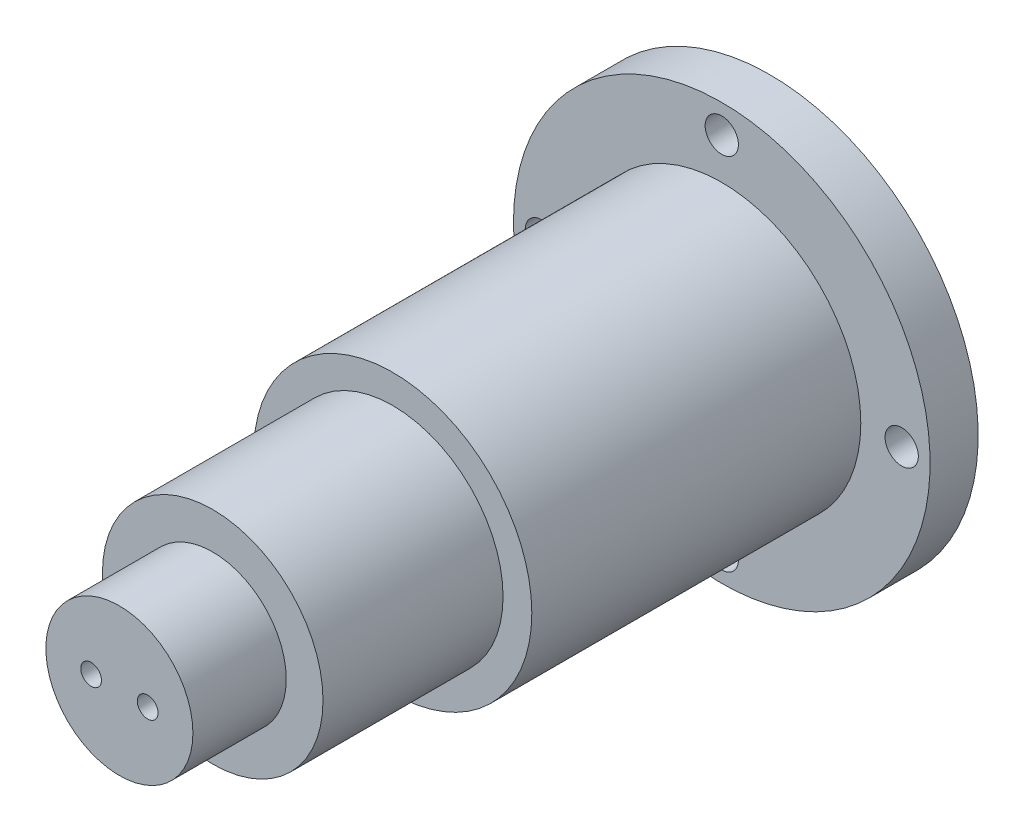
from build123d import *

# Parameters (mm, degrees)
SKETCH1_W                      = 22.1
SKETCH1_H                      = 5.1
SKETCH2_R                      = 14.75
BOSS_EXTRUDE1_DEPTH            = 34.9
SKETCH3_R                      = 11.7
BOSS_EXTRUDE2_DEPTH            = 19.1
SKETCH4_R                      = 7.8
BOSS_EXTRUDE3_DEPTH            = 9.9
M10_CLEARANCE_HOLE1_D          = 12.7
M10_CLEARANCE_HOLE1_DEPTH      = 18.81
M10_CLEARANCE_HOLE1_TIP        = 3.815464931
F_2_2_2_2_DIAMETER_HOLE1_D     = 2.2
F_2_2_2_2_DIAMETER_HOLE1_DEPTH = 15
M3_CLEARANCE_HOLE1_D           = 3.53
M3_CLEARANCE_HOLE1_DEPTH       = 69
CHAMFER1_SIZE                  = 2


with BuildPart() as part:
    # Sketch1 → Revolve1 (revolve)
    with BuildSketch(Plane.XZ, mode=Mode.PRIVATE) as revolve1_sk:
        with Locations((11.05, 2.55)):
            Rectangle(SKETCH1_W, SKETCH1_H)
    revolve(revolve1_sk.sketch.rotate(Axis((0, 0, 5.1), (0, 0, -1)), 180), axis=Axis((0, 0, 5.1), (0, 0, -1)))

    # Sketch2 → Boss-Extrude1 (add)
    with BuildSketch(Plane.XY.offset(5.1)):
        Circle(SKETCH2_R)
    extrude(amount=BOSS_EXTRUDE1_DEPTH)

    # Sketch3 → Boss-Extrude2 (add)
    with BuildSketch(Plane.XY.offset(40)):
        Circle(SKETCH3_R)
    extrude(amount=BOSS_EXTRUDE2_DEPTH)

    # Sketch4 → Boss-Extrude3 (add)
    with BuildSketch(Plane.XY.offset(59.1)):
        Circle(SKETCH4_R)
    extrude(amount=BOSS_EXTRUDE3_DEPTH)

    # M10 Clearance Hole1
    with Locations(Plane(origin=(0, 0, 0), x_dir=(-1, 0, 0), z_dir=(0, 0, -1))):
        with Locations((0, 0)):
            Hole(M10_CLEARANCE_HOLE1_D / 2, depth=M10_CLEARANCE_HOLE1_DEPTH)
            with Locations((0, 0, -(M10_CLEARANCE_HOLE1_DEPTH + M10_CLEARANCE_HOLE1_TIP / 2))):  # 118° drill point
                Cone(0, M10_CLEARANCE_HOLE1_D / 2, M10_CLEARANCE_HOLE1_TIP, mode=Mode.SUBTRACT)

    # Ø2.2 (2.2) Diameter Hole1
    with Locations(Plane.XY.offset(69)):
        with Locations((-3, 0), (3, 0)):
            Hole(F_2_2_2_2_DIAMETER_HOLE1_D / 2, depth=F_2_2_2_2_DIAMETER_HOLE1_DEPTH)

    # M3 Clearance Hole1
    with Locations(Plane(origin=(0, 0, 0), x_dir=(-1, 0, 0), z_dir=(0, 0, -1))):
        with Locations((0, 19.0875), (-19.0875, 0), (0, -19.0875), (19.0875, 0)):
            Hole(M3_CLEARANCE_HOLE1_D / 2, depth=M3_CLEARANCE_HOLE1_DEPTH)

    # Chamfer1
    chamfer1_edges = [part.edges().sort_by_distance(p)[0] for p in [
        (-6.35, 0, 0),
    ]]
    chamfer(chamfer1_edges, length=CHAMFER1_SIZE)


solid = part.part
